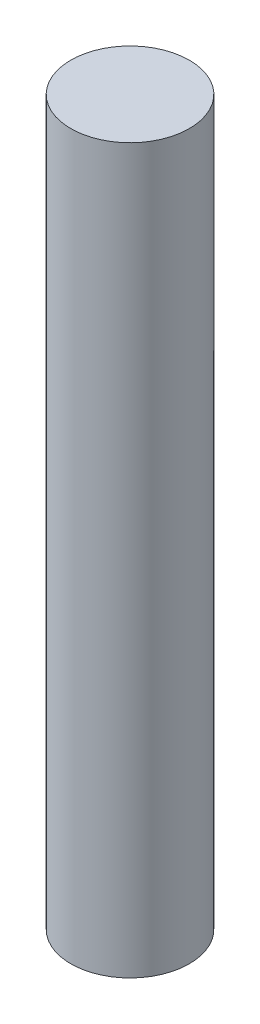
from build123d import *

# Parameters (mm, degrees)
SKETCH1_R           = 10
BOSS_EXTRUDE1_DEPTH = 61


with BuildPart() as part:
    # Sketch1 → Boss-Extrude1 (new, symmetric)
    with BuildSketch(Plane(origin=(0, 0, 0), x_dir=(1, 0, 0), z_dir=(0, 1, 0))):
        with Locations(Location((0, 0, 0), (0, 0, 90))):
            Circle(SKETCH1_R)
    extrude(amount=BOSS_EXTRUDE1_DEPTH, both=True)


solid = part.part
